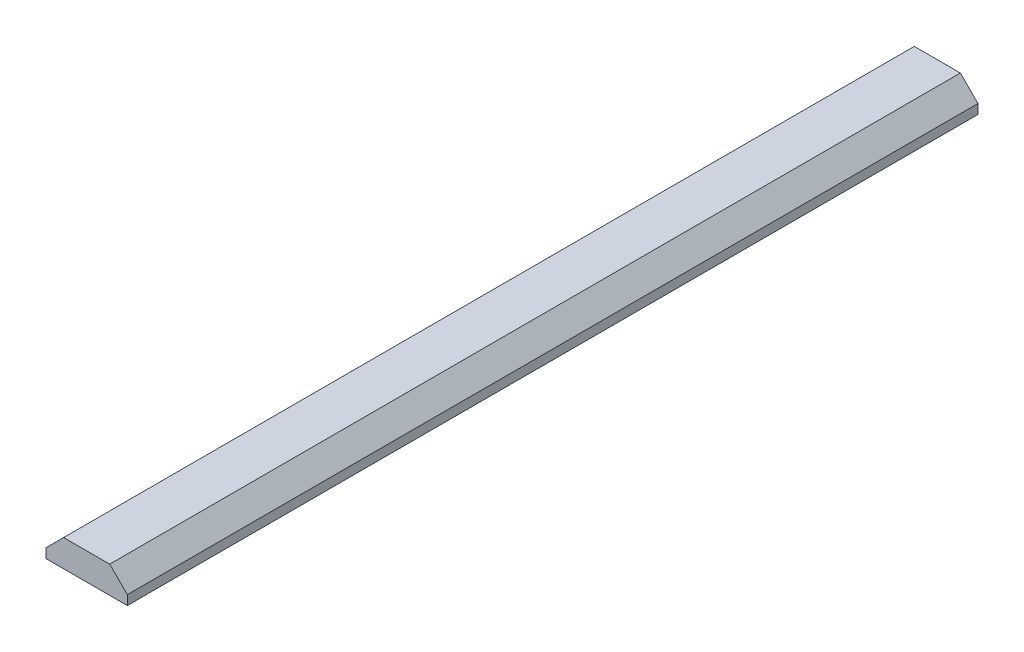
from build123d import *

# Parameters (mm, degrees)
AUFSATZ_LINEAR_AUSTRAGEN1_DEPTH = 125.5


with BuildPart() as part:
    # Skizze1 → Aufsatz-Linear austragen1 (new body)
    with BuildSketch(Plane.XY):
        Polygon((3.4, 1.808858787), (-3.4, 1.808858787), (-6, -0.791141213), (-6, -2.191141213), (6, -2.191141213), (6, -0.791141213), align=None)
    extrude(amount=AUFSATZ_LINEAR_AUSTRAGEN1_DEPTH)


solid = part.part
